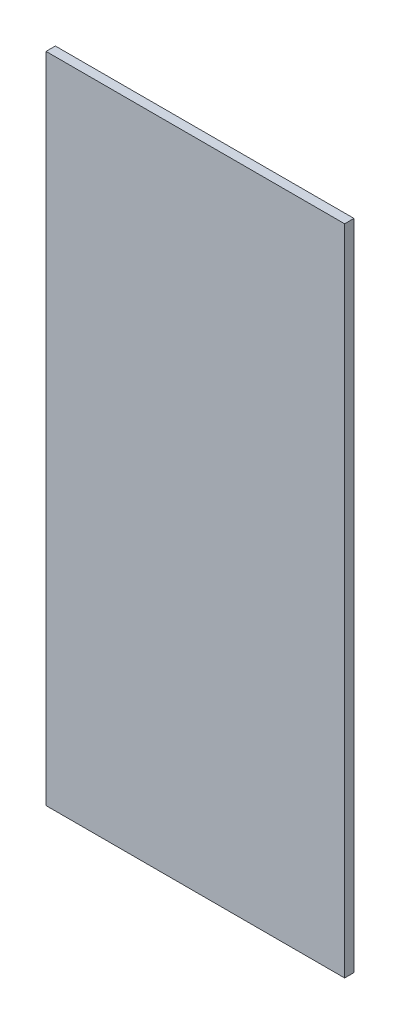
from build123d import *

# Parameters (mm, degrees)
CROQUIS1_W              = 320
CROQUIS1_H              = 700
SALIENTE_EXTRUIR1_DEPTH = 10


with BuildPart() as part:
    # Croquis1 → Saliente-Extruir1 (new body)
    with BuildSketch(Plane.XY):
        with Locations((160, 350)):
            Rectangle(CROQUIS1_W, CROQUIS1_H)
    extrude(amount=SALIENTE_EXTRUIR1_DEPTH)


solid = part.part
